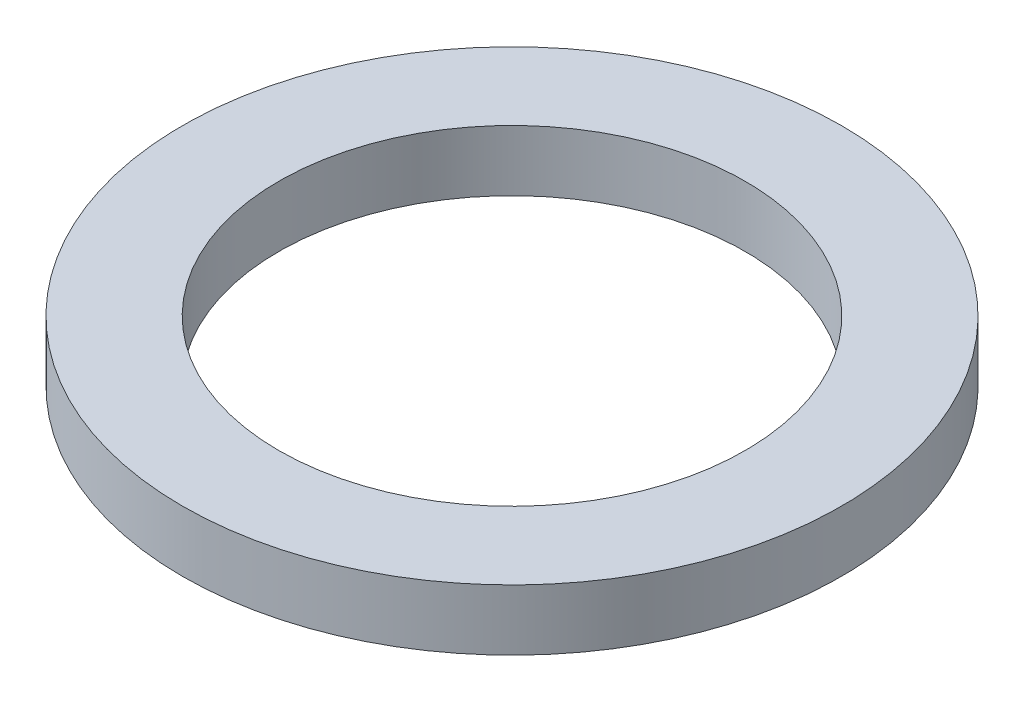
from build123d import *

# Parameters (mm, degrees)
SKETCH1_R      = 32.5
SKETCH1_R_2    = 23
EXTRUDE1_DEPTH = 6


with BuildPart() as part:
    # Sketch1 → Extrude1 (new body)
    with BuildSketch(Plane(origin=(0, 0, 0), x_dir=(1, 0, 0), z_dir=(0, 1, 0))):
        with Locations(Location((0, 0, 0), (0, 0, 270))):
            Circle(SKETCH1_R)
        with Locations(Location((0, 0, 0), (0, 0, 270))):
            Circle(SKETCH1_R_2, mode=Mode.SUBTRACT)
    extrude(amount=EXTRUDE1_DEPTH)


solid = part.part
